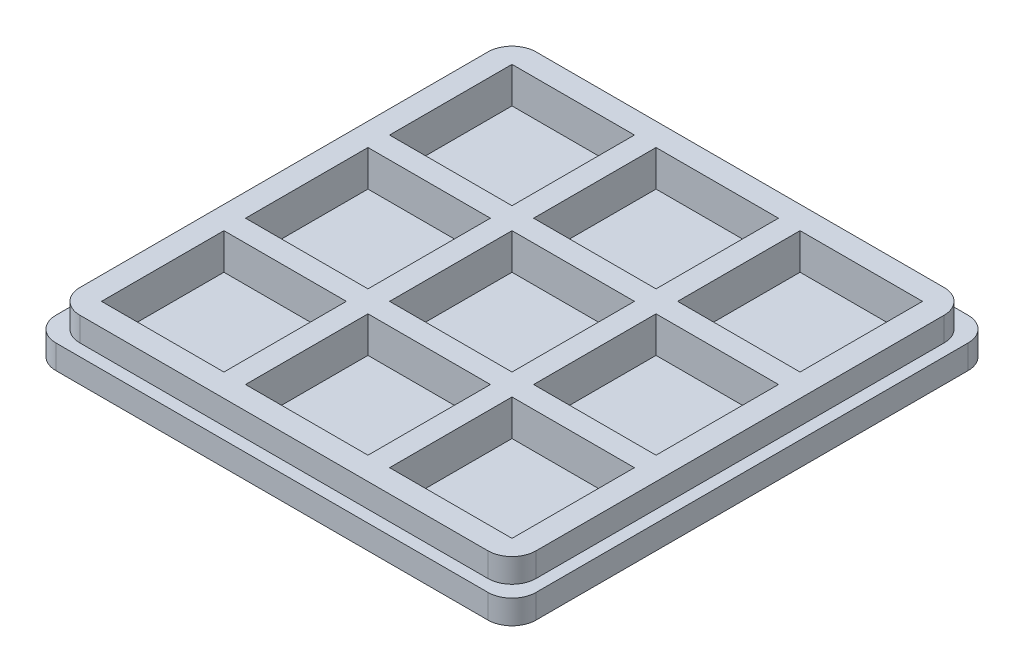
from build123d import *

# Parameters (mm, degrees)
SKETCH_1_W          = 200
SKETCH_1_H          = 200
SKETCH_1_W_2        = 51
SKETCH_1_H_2        = 51
EXTRUDE_1_DEPTH     = 20
SKETCH_1_2_W        = 200
SKETCH_1_2_H        = 200
EXTRUDE_2_DEPTH     = 5
SKETCH_2_W          = 200
SKETCH_2_H          = 200
SKETCH_2_W_2        = 190
SKETCH_2_H_2        = 190
CUT_EXTRUDE_1_DEPTH = 10
FILLET_1_R          = 10


with BuildPart() as part:
    # 草图1 → 凸台-拉伸1 (new body)
    with BuildSketch(Plane(origin=(0, 0, 0), x_dir=(1, 0, 0), z_dir=(0, 1, 0))):
        Rectangle(SKETCH_1_W, SKETCH_1_H)
        with Locations((0, 60)):
            Rectangle(SKETCH_1_W_2, SKETCH_1_H_2, mode=Mode.SUBTRACT)
        with Locations((-60, 60)):
            Rectangle(SKETCH_1_W_2, SKETCH_1_H_2, mode=Mode.SUBTRACT)
        with Locations((60, 60)):
            Rectangle(SKETCH_1_W_2, SKETCH_1_H_2, mode=Mode.SUBTRACT)
        Rectangle(SKETCH_1_W_2, SKETCH_1_H_2, mode=Mode.SUBTRACT)
        with Locations((60, 0)):
            Rectangle(SKETCH_1_W_2, SKETCH_1_H_2, mode=Mode.SUBTRACT)
        with Locations((0, -60)):
            Rectangle(SKETCH_1_W_2, SKETCH_1_H_2, mode=Mode.SUBTRACT)
        with Locations((60, -60)):
            Rectangle(SKETCH_1_W_2, SKETCH_1_H_2, mode=Mode.SUBTRACT)
        with Locations((-60, 0)):
            Rectangle(SKETCH_1_W_2, SKETCH_1_H_2, mode=Mode.SUBTRACT)
        with Locations((-60, -60)):
            Rectangle(SKETCH_1_W_2, SKETCH_1_H_2, mode=Mode.SUBTRACT)
    extrude(amount=EXTRUDE_1_DEPTH)

    # 草图1<2> → 凸台-拉伸2 (add)
    with BuildSketch(Plane(origin=(0, 0, 0), x_dir=(1, 0, 0), z_dir=(0, 1, 0))):
        Rectangle(SKETCH_1_2_W, SKETCH_1_2_H)
    extrude(amount=EXTRUDE_2_DEPTH)

    # 草图2 → 切除-拉伸1 (cut)
    with BuildSketch(Plane(origin=(0, 20, 0), x_dir=(1, 0, 0), z_dir=(0, 1, 0))):
        Rectangle(SKETCH_2_W, SKETCH_2_H)
        Rectangle(SKETCH_2_W_2, SKETCH_2_H_2, mode=Mode.SUBTRACT)
    extrude(amount=-CUT_EXTRUDE_1_DEPTH, mode=Mode.SUBTRACT)

    # 圆角1
    fillet_1_edges = [part.edges().sort_by_distance(p)[0] for p in [
        (-95, 15, 95),
        (-100, 5, 100),
        (95, 15, 95),
        (100, 5, 100),
        (95, 15, -95),
        (100, 5, -100),
        (-95, 15, -95),
        (-100, 5, -100),
    ]]
    fillet(fillet_1_edges, radius=FILLET_1_R)


solid = part.part
